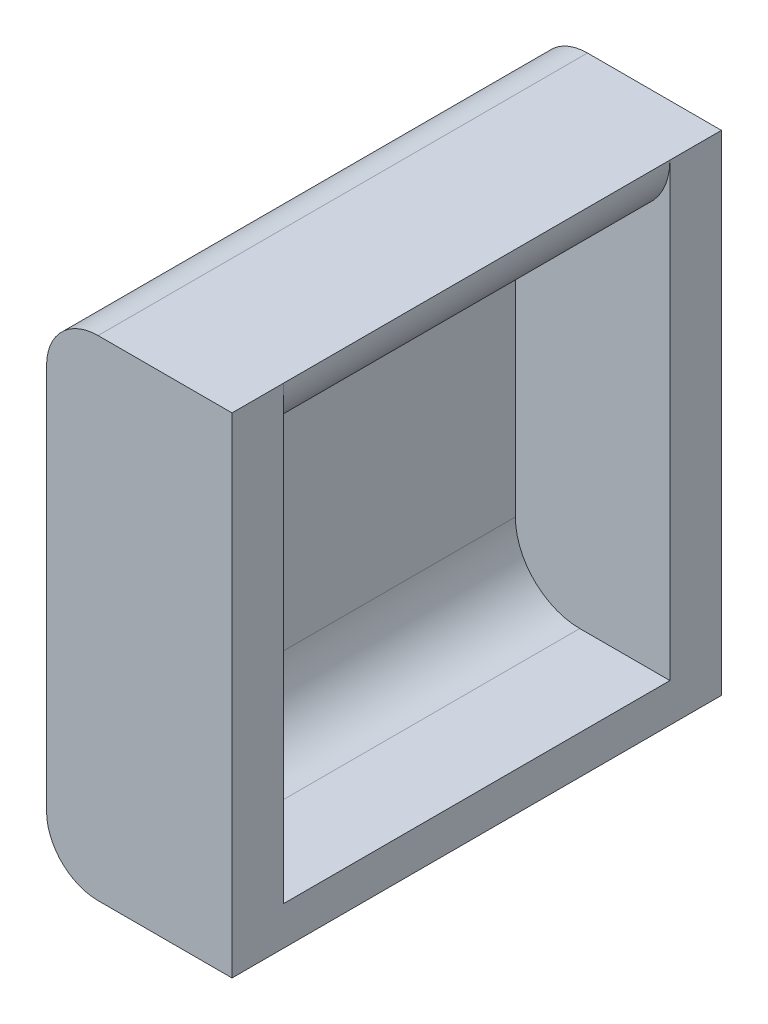
from build123d import *

# Parameters (mm, degrees)
BOSS_EXTRUDE1_DEPTH = 19.05
BOSS_EXTRUDE2_START = 2.54
BOSS_EXTRUDE2_DEPTH = 2.54
BOSS_EXTRUDE3_DEPTH = 2.54
FILLET1_R           = 2.54


with BuildPart() as part:
    # Sketch1 → Boss-Extrude1 (new body)
    with BuildSketch(Plane.XY):
        with BuildLine():
            ThreePointArc((-22.987, -27.7495), (-20.74193597, -26.81956403), (-19.812, -24.5745))
            Line((-19.812, -24.5745), (-28.956, -24.5745))
            Line((-28.956, -24.5745), (-28.956, -48.7045))
            Line((-28.956, -48.7045), (-19.812, -48.7045))
            Line((-19.812, -48.7045), (-19.812, -46.7995))
            Line((-19.812, -46.7995), (-24.257, -46.7995))
            ThreePointArc((-24.257, -46.7995), (-26.50206403, -45.86956403), (-27.432, -43.6245))
            Line((-27.432, -43.6245), (-27.432, -30.9245))
            ThreePointArc((-27.432, -30.9245), (-26.50206403, -28.67943597), (-24.257, -27.7495))
            Line((-24.257, -27.7495), (-22.987, -27.7495))
        make_face()
    extrude(amount=-BOSS_EXTRUDE1_DEPTH)

    # Sketch2 → Boss-Extrude2 (add)
    with BuildSketch(Plane.XY.offset(BOSS_EXTRUDE2_START)):
        with BuildLine():
            Line((-19.812, -46.7995), (-24.257, -46.7995))
            ThreePointArc((-24.257, -46.7995), (-26.50206403, -45.86956403), (-27.432, -43.6245))
            Line((-27.432, -43.6245), (-27.432, -30.9245))
            ThreePointArc((-27.432, -30.9245), (-26.50206403, -28.67943597), (-24.257, -27.7495))
            Line((-24.257, -27.7495), (-22.987, -27.7495))
            ThreePointArc((-22.987, -27.7495), (-20.74193597, -26.81956403), (-19.812, -24.5745))
            Line((-19.812, -24.5745), (-28.956, -24.5745))
            Line((-28.956, -24.5745), (-28.956, -48.7045))
            Line((-28.956, -48.7045), (-19.812, -48.7045))
            Line((-19.812, -48.7045), (-19.812, -46.7995))
        make_face()
        with BuildLine():
            Line((-19.812, -46.7995), (-19.812, -24.5745))
            ThreePointArc((-19.812, -24.5745), (-20.74193597, -26.81956403), (-22.987, -27.7495))
            Line((-22.987, -27.7495), (-24.257, -27.7495))
            ThreePointArc((-24.257, -27.7495), (-26.50206403, -28.67943597), (-27.432, -30.9245))
            Line((-27.432, -30.9245), (-27.432, -43.6245))
            ThreePointArc((-27.432, -43.6245), (-26.50206403, -45.86956403), (-24.257, -46.7995))
            Line((-24.257, -46.7995), (-19.812, -46.7995))
        make_face()
    extrude(amount=-BOSS_EXTRUDE2_DEPTH)

    # Sketch3 → Boss-Extrude3 (add)
    with BuildSketch(Plane(origin=(0, 0, -19.05), x_dir=(-1, 0, 0), z_dir=(0, 0, -1))):
        with BuildLine():
            ThreePointArc((22.987, -27.7495), (20.74193597, -26.81956403), (19.812, -24.5745))
            Line((19.812, -24.5745), (19.812, -46.7995))
            Line((19.812, -46.7995), (24.257, -46.7995))
            ThreePointArc((24.257, -46.7995), (26.50206403, -45.86956403), (27.432, -43.6245))
            Line((27.432, -43.6245), (27.432, -30.9245))
            ThreePointArc((27.432, -30.9245), (26.50206403, -28.67943597), (24.257, -27.7495))
            Line((24.257, -27.7495), (22.987, -27.7495))
        make_face()
        with BuildLine():
            Line((27.432, -30.9245), (27.432, -43.6245))
            ThreePointArc((27.432, -43.6245), (26.50206403, -45.86956403), (24.257, -46.7995))
            Line((24.257, -46.7995), (19.812, -46.7995))
            Line((19.812, -46.7995), (19.812, -48.7045))
            Line((19.812, -48.7045), (28.956, -48.7045))
            Line((28.956, -48.7045), (28.956, -24.5745))
            Line((28.956, -24.5745), (19.812, -24.5745))
            ThreePointArc((19.812, -24.5745), (20.74193597, -26.81956403), (22.987, -27.7495))
            Line((22.987, -27.7495), (24.257, -27.7495))
            ThreePointArc((24.257, -27.7495), (26.50206403, -28.67943597), (27.432, -30.9245))
        make_face()
    extrude(amount=BOSS_EXTRUDE3_DEPTH)

    # Fillet1
    fillet1_edges = [part.edges().sort_by_distance(p)[0] for p in [
        (-28.956, -48.7045, -9.525),
        (-28.956, -24.5745, -9.525),
    ]]
    fillet(fillet1_edges, radius=FILLET1_R)


solid = part.part
